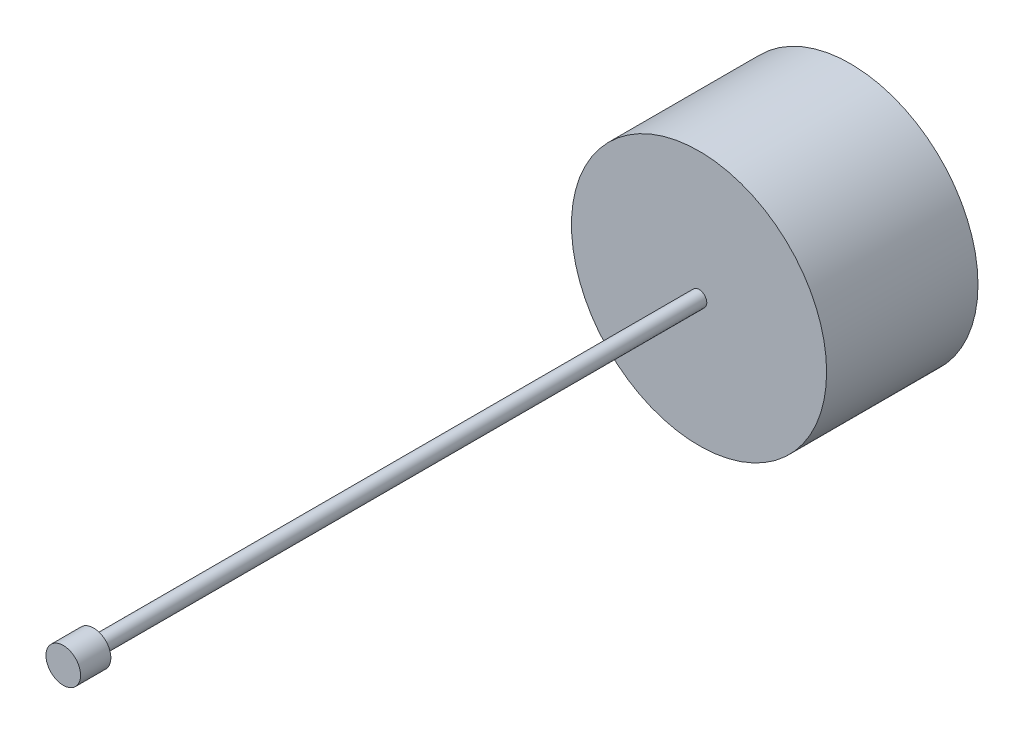
from build123d import *

# Parameters (mm, degrees)
SKETCH1_R           = 29.5
BOSS_EXTRUDE1_DEPTH = 35
SKETCH2_R           = 1.7907
BOSS_EXTRUDE2_DEPTH = 140
SKETCH3_R           = 4
BOSS_EXTRUDE3_DEPTH = 7


with BuildPart() as part:
    # Sketch1 → Boss-Extrude1 (new body)
    with BuildSketch(Plane.XY):
        Circle(SKETCH1_R)
    extrude(amount=BOSS_EXTRUDE1_DEPTH)

    # Sketch2 → Boss-Extrude2 (add)
    with BuildSketch(Plane.XY.offset(35)):
        Circle(SKETCH2_R)
    extrude(amount=BOSS_EXTRUDE2_DEPTH)

    # Sketch3 → Boss-Extrude3 (add)
    with BuildSketch(Plane.XY.offset(175)):
        Circle(SKETCH3_R)
    extrude(amount=BOSS_EXTRUDE3_DEPTH)


solid = part.part
